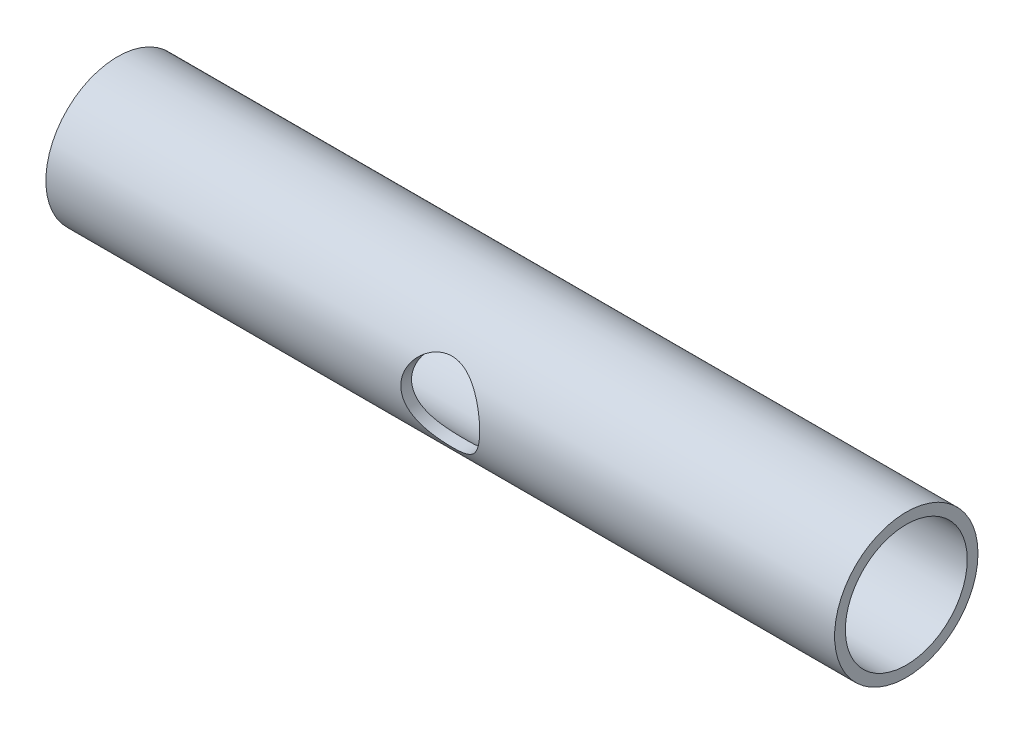
from build123d import *

# Parameters (mm, degrees)
SKETCH_1_R               = 10
SKETCH_1_R_2             = 8.5
EXTRUDE_1_DEPTH          = 110
CUT_EXTRUDE_1_DEPTH      = 111.905365064
CUT_EXTRUDE_1_DEPTH_BACK = 111.905365064
SKETCH_2_R               = 5.5


with BuildPart() as part:
    # 草图1 → 凸台-拉伸1 (new body)
    with BuildSketch(Plane(origin=(0, 0, 0), x_dir=(0, 0, -1), z_dir=(1, 0, 0))):
        Circle(SKETCH_1_R)
        Circle(SKETCH_1_R_2, mode=Mode.SUBTRACT)
    extrude(amount=EXTRUDE_1_DEPTH)

    # 草图2 → 切除-拉伸1 (cut, two sides: drawn at the far end of the back side and taken through both)
    with BuildSketch(Plane.XY.offset(-CUT_EXTRUDE_1_DEPTH_BACK)):
        with Locations((55, 0)):
            Circle(SKETCH_2_R)
    extrude(amount=CUT_EXTRUDE_1_DEPTH + CUT_EXTRUDE_1_DEPTH_BACK, mode=Mode.SUBTRACT)


solid = part.part
